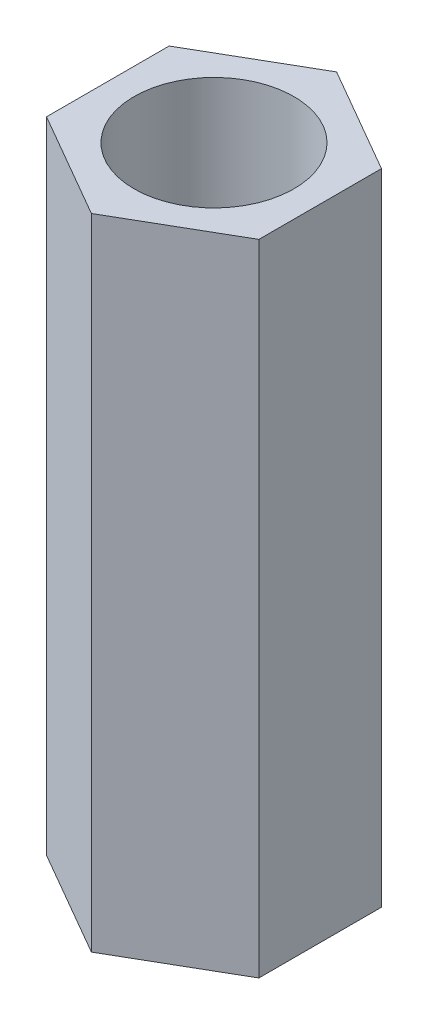
from build123d import *

# Parameters (mm, degrees)
SKETCH_1_R      = 1.5
EXTRUDE_1_DEPTH = 12


with BuildPart() as part:
    # 草图1 → 凸台-拉伸1 (new body)
    with BuildSketch(Plane(origin=(0, 0, 0), x_dir=(1, 0, 0), z_dir=(0, 1, 0))):
        Polygon((1.991858429, 1.15), (0, 2.3), (-1.991858429, 1.15), (-1.991858429, -1.15), (0, -2.3), (1.991858429, -1.15), align=None)
        with Locations(Location((0, 0, 0), (0, 0, 270))):
            Circle(SKETCH_1_R, mode=Mode.SUBTRACT)
    extrude(amount=EXTRUDE_1_DEPTH)


solid = part.part
